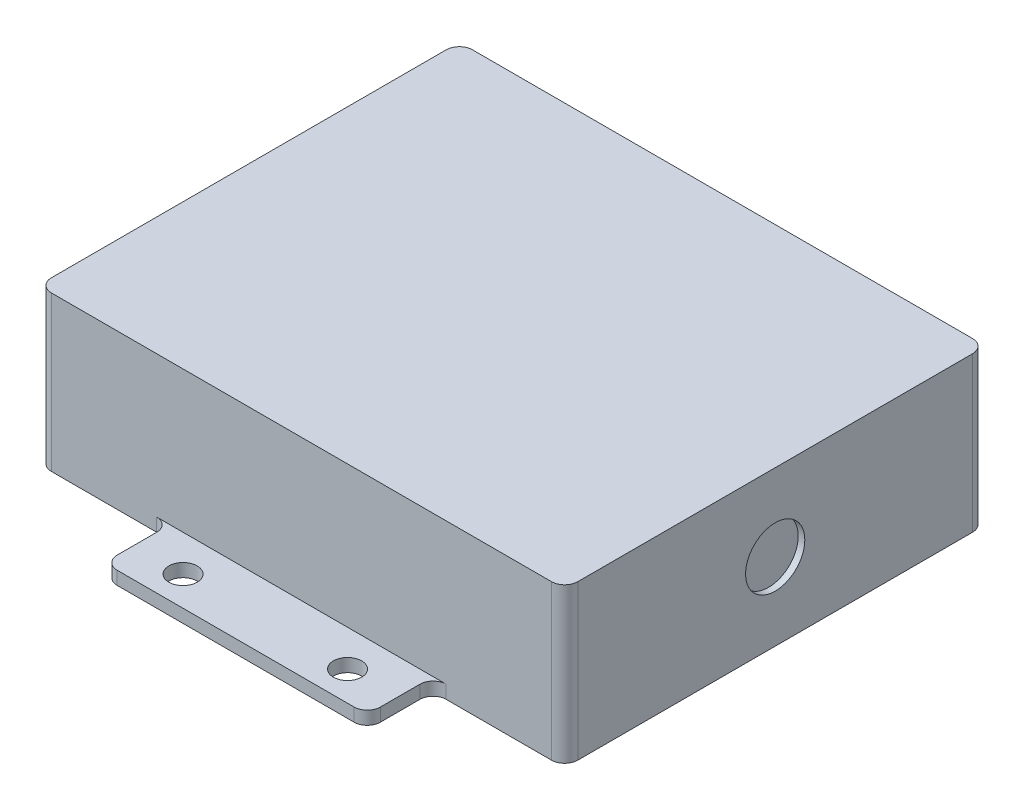
from build123d import *

# Parameters (mm, degrees)
SKETCH1_W            = 80
SKETCH1_H            = 84
BOSS_EXTRUDE1_DEPTH  = 23.5
M4_CLEARANCE_HOLE1_D = 4.3
SKETCH5_W            = 32
SKETCH5_H            = 13
CUT_EXTRUDE1_DEPTH   = 1
SKETCH6_R            = 4.5
CUT_EXTRUDE2_DEPTH   = 1
SKETCH7_W            = 80
SKETCH7_H            = 10
CUT_EXTRUDE3_DEPTH   = 21.5
SKETCH8_W            = 20
SKETCH8_H            = 10
CUT_EXTRUDE4_DEPTH   = 62.85668921
FILLET1_R            = 2


with BuildPart() as part:
    # Sketch1 → Boss-Extrude1 (new body)
    with BuildSketch(Plane(origin=(0, 0, 0), x_dir=(1, 0, 0), z_dir=(0, 1, 0))):
        Rectangle(SKETCH1_W, SKETCH1_H)
    extrude(amount=BOSS_EXTRUDE1_DEPTH)

    # M4 Clearance Hole1 (through all)
    with Locations(Plane(origin=(0, 23.5, 0), x_dir=(1, 0, 0), z_dir=(0, 1, 0))):
        with Locations((-12.5, 37.5), (12.5, 37.5), (-12.5, -37.5), (12.5, -37.5)):
            Hole(M4_CLEARANCE_HOLE1_D / 2)

    # Sketch5 → Cut-Extrude1 (cut)
    with BuildSketch(Plane.ZY.offset(40)):
        with Locations((0, 13.5)):
            Rectangle(SKETCH5_W, SKETCH5_H)
    extrude(amount=-CUT_EXTRUDE1_DEPTH, mode=Mode.SUBTRACT)

    # Sketch6 → Cut-Extrude2 (cut)
    with BuildSketch(Plane(origin=(40, 0, 0), x_dir=(0, 0, -1), z_dir=(1, 0, 0))):
        with Locations((0, 11.75)):
            Circle(SKETCH6_R)
    extrude(amount=-CUT_EXTRUDE2_DEPTH, mode=Mode.SUBTRACT)

    # Sketch7 → Cut-Extrude3 (cut)
    with BuildSketch(Plane(origin=(0, 23.5, 0), x_dir=(1, 0, 0), z_dir=(0, 1, 0))):
        with Locations((0, 37)):
            Rectangle(SKETCH7_W, SKETCH7_H)
        with Locations((0, -37)):
            Rectangle(SKETCH7_W, SKETCH7_H)
    extrude(amount=-CUT_EXTRUDE3_DEPTH, mode=Mode.SUBTRACT)

    # Sketch8 → Cut-Extrude4 (cut, through all)
    with BuildSketch(Plane(origin=(0, 2, 0), x_dir=(1, 0, 0), z_dir=(0, 1, 0))):
        with Locations((-30, 37)):
            Rectangle(SKETCH8_W, SKETCH8_H)
        with Locations((30, 37)):
            Rectangle(SKETCH8_W, SKETCH8_H)
        with Locations((-30, -37)):
            Rectangle(SKETCH8_W, SKETCH8_H)
        with Locations((30, -37)):
            Rectangle(SKETCH8_W, SKETCH8_H)
    extrude(amount=-CUT_EXTRUDE4_DEPTH, mode=Mode.SUBTRACT)

    # Fillet1
    fillet1_edges = [part.edges().sort_by_distance(p)[0] for p in [
        (20, 1, -32),
        (20, 1, -42),
        (-20, 1, 32),
        (-20, 1, 42),
        (20, 1, 42),
        (20, 1, 32),
        (-20, 1, -42),
        (-20, 1, -32),
        (40, 11.75, -32),
        (-40, 11.75, -32),
        (-40, 11.75, 32),
        (40, 11.75, 32),
    ]]
    fillet(fillet1_edges, radius=FILLET1_R)


solid = part.part
